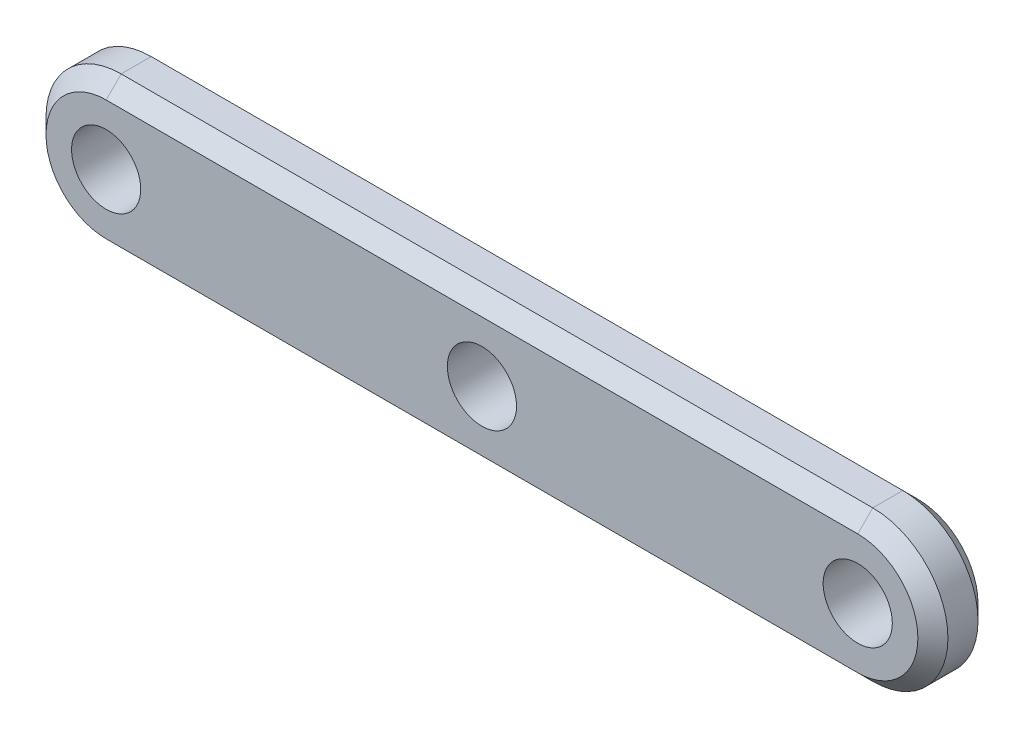
from build123d import *

# Parameters (mm, degrees)
SKETCH1_R           = 2.3
BOSS_EXTRUDE1_DEPTH = 4
CHAMFER1_SIZE       = 1


with BuildPart() as part:
    # Sketch1 → Boss-Extrude1 (new body)
    with BuildSketch(Plane.XY):
        with BuildLine():
            Line((50, 5), (0, 5))
            ThreePointArc((0, 5), (-5, 0), (0, -5))
            Line((0, -5), (50, -5))
            ThreePointArc((50, -5), (55, 0), (50, 5))
        make_face()
        with Locations((25, 0)):
            Circle(SKETCH1_R, mode=Mode.SUBTRACT)
        Circle(SKETCH1_R, mode=Mode.SUBTRACT)
        with Locations((50, 0)):
            Circle(SKETCH1_R, mode=Mode.SUBTRACT)
    extrude(amount=BOSS_EXTRUDE1_DEPTH)

    # Chamfer1
    chamfer1_edges = [part.edges().sort_by_distance(p)[0] for p in [
        (-5, 0, 0),
        (25, 5, 0),
        (55, 0, 0),
        (25, -5, 0),
        (55, 0, 4),
        (25, 5, 4),
        (-5, 0, 4),
        (25, -5, 4),
    ]]
    chamfer(chamfer1_edges, length=CHAMFER1_SIZE)


solid = part.part
